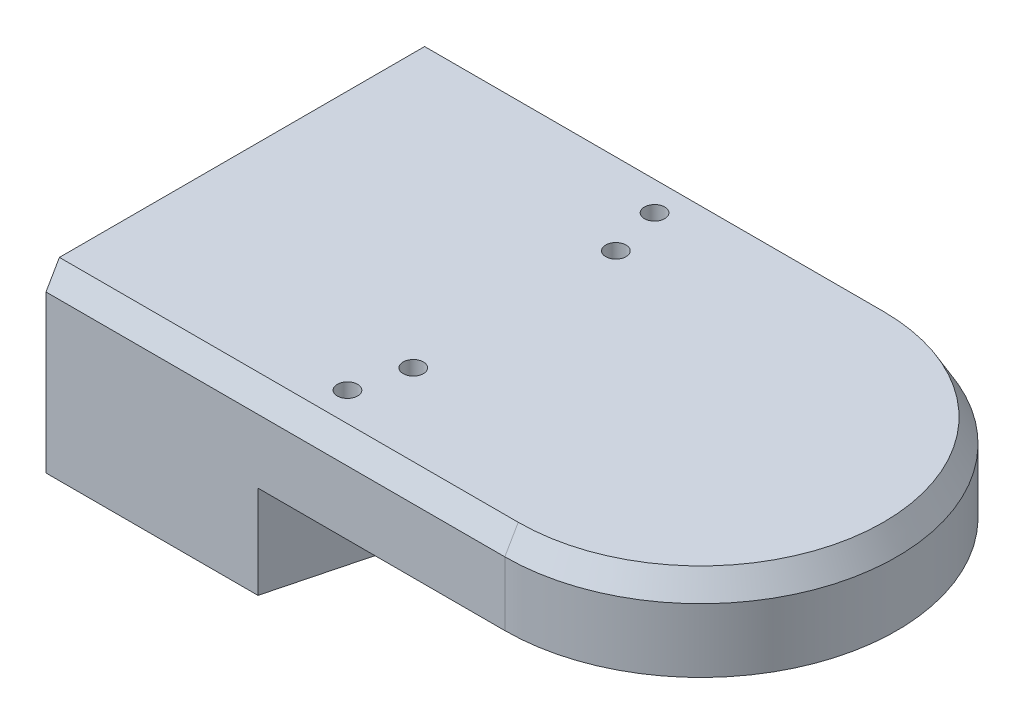
from build123d import *
from OCP.BRepFilletAPI import BRepFilletAPI_MakeChamfer

# Parameters (mm, degrees)
SALIENTE_EXTRUIR2_DEPTH = 23
CROQUIS7_R              = 20
CORTAR_EXTRUIR1_DEPTH   = 16
CROQUIS8_R              = 10.25
CORTAR_EXTRUIR2_DEPTH   = 65.838641661
SALIENTE_EXTRUIR3_START = 32
CROQUIS9_R              = 20
CROQUIS9_R_2            = 3.075
CROQUIS9_R_3            = 10.25
SALIENTE_EXTRUIR3_DEPTH = 32
CORTAR_EXTRUIR3_START   = -7
CROQUIS10_R             = 20
CORTAR_EXTRUIR3_DEPTH   = 112.607172695
SALIENTE_EXTRUIR4_START = 20
CROQUIS11_R             = 3.075
CROQUIS11_R_2           = 20
SALIENTE_EXTRUIR4_DEPTH = 20
CROQUIS12_R             = 63
CORTAR_EXTRUIR4_DEPTH   = 3
CROQUIS13_R             = 55
CORTAR_EXTRUIR5_DEPTH   = 10
SALIENTE_EXTRUIR5_START = 10
SALIENTE_EXTRUIR5_DEPTH = 10
CHAFL_N1_SIZE           = 8
CHAFL_N1_SIZE2          = 4.618802154
CROQUIS15_R             = 6
CORTAR_EXTRUIR6_DEPTH   = 14.8
CORTAR_EXTRUIR7_REACH   = 233.334
CROQUIS17_R             = 1.5
CORTAR_EXTRUIR9_REACH   = 225.907
CROQUIS19_R             = 1.5
CORTAR_EXTRUIR10_START  = -50
CORTAR_EXTRUIR10_DEPTH  = 50
CORTAR_EXTRUIR11_DEPTH  = 50
CROQUIS22_R             = 3
CORTAR_EXTRUIR12_DEPTH  = 3
CROQUIS23_R             = 3
CORTAR_EXTRUIR13_DEPTH  = 3
CROQUIS25_R             = 2.5
CORTAR_EXTRUIR15_DEPTH  = 30
CROQUIS24_R             = 2.5
CORTAR_EXTRUIR14_DEPTH  = 30
CROQUIS26_R             = 2
CORTAR_EXTRUIR16_DEPTH  = 223.070371729
CROQUIS27_R             = 3.5
CORTAR_EXTRUIR17_DEPTH  = 5
CORTAR_EXTRUIR18_DEPTH  = 3.25
CROQUIS29_R             = 1.5
CORTAR_EXTRUIR19_DEPTH  = 10


with BuildPart() as part:
    # Croquis2 → Saliente-Extruir2 (new body)
    with BuildSketch(Plane(origin=(0, 0, 0), x_dir=(1, 0, 0), z_dir=(0, 1, 0))):
        with BuildLine():
            Line((32.725022686, -35), (-35, -35))
            Line((-35, -35), (-35, 35))
            Line((-35, 35), (38, 35))
            Line((38, 35), (52.182846342, -19.705264464))
            ThreePointArc((52.182846342, -19.705264464), (38.869791903, -20.762030653), (32.5, -32.5))
            ThreePointArc((32.5, -32.5), (32.556369153, -33.755053307), (32.725022686, -35))
        make_face()
    extrude(amount=SALIENTE_EXTRUIR2_DEPTH)

    # Croquis7 → Cortar-Extruir1 (cut)
    with BuildSketch(Plane(origin=(0, 23, 0), x_dir=(1, 0, 0), z_dir=(0, 1, 0))):
        with Locations(Location((1.5, -1.5, 0), (0, 0, 270))):
            Circle(CROQUIS7_R)
    extrude(amount=-CORTAR_EXTRUIR1_DEPTH, mode=Mode.SUBTRACT)

    # Croquis8 → Cortar-Extruir2 (cut, through all)
    with BuildSketch(Plane(origin=(0, 7, 0), x_dir=(1, 0, 0), z_dir=(0, 1, 0))):
        with Locations(Location((1.5, -1.5, 0), (0, 0, 270))):
            Circle(CROQUIS8_R)
    extrude(amount=-CORTAR_EXTRUIR2_DEPTH, mode=Mode.SUBTRACT)

    # Croquis9 → Saliente-Extruir3 (add)
    with BuildSketch(Plane(origin=(0, 23, 0), x_dir=(1, 0, 0), z_dir=(0, 1, 0)).offset(SALIENTE_EXTRUIR3_START)):
        with BuildLine():
            Line((-35, 35), (-35, -100))
            Line((-35, -100), (38, -100))
            Line((38, -100), (54.849357366, -35.009621588))
            ThreePointArc((54.849357366, -35.009621588), (55.169388384, -32.5), (54.849357366, -29.990378412))
            Line((54.849357366, -29.990378412), (38, 35))
            Line((38, 35), (-35, 35))
        make_face()
        with Locations(Location((1.5, -1.5, 0), (0, 0, 270))):
            Circle(CROQUIS9_R, mode=Mode.SUBTRACT)
        with Locations(Location((46.5, -32.5, 0), (0, 0, 270))):
            Circle(CROQUIS9_R_2, mode=Mode.SUBTRACT)
        with Locations(Location((1.5, -63.5, 0), (0, 0, 90))):
            Circle(CROQUIS9_R_3, mode=Mode.SUBTRACT)
    extrude(amount=-SALIENTE_EXTRUIR3_DEPTH)

    # Croquis10 → Cortar-Extruir3 (cut, through all)
    with BuildSketch(Plane.XZ.offset(-23).offset(CORTAR_EXTRUIR3_START)):
        with Locations(Location((1.5, 63.5, 0), (0, 0, 90))):
            Circle(CROQUIS10_R)
    extrude(amount=-CORTAR_EXTRUIR3_DEPTH, mode=Mode.SUBTRACT)

    # Croquis11 → Saliente-Extruir4 (add)
    with BuildSketch(Plane(origin=(0, 55, 0), x_dir=(1, 0, 0), z_dir=(0, 1, 0)).offset(SALIENTE_EXTRUIR4_START)):
        with BuildLine():
            Line((123, 35), (-35, 35))
            Line((-35, 35), (-35, -100))
            Line((-35, -100), (123, -100))
            ThreePointArc((123, -100), (190.5, -32.5), (123, 35))
        make_face()
        with Locations(Location((46.5, -32.5, 0), (0, 0, 270))):
            Circle(CROQUIS11_R, mode=Mode.SUBTRACT)
        with Locations(Location((1.5, -63.5, 0), (0, 0, 270))):
            Circle(CROQUIS11_R_2, mode=Mode.SUBTRACT)
        with Locations(Location((1.5, -1.5, 0), (0, 0, 270))):
            Circle(CROQUIS11_R_2, mode=Mode.SUBTRACT)
    extrude(amount=-SALIENTE_EXTRUIR4_DEPTH)

    # Croquis12 → Cortar-Extruir4 (cut)
    with BuildSketch(Plane.XZ.offset(-55)):
        with Locations(Location((123, 32.5, 0), (0, 0, 270))):
            Circle(CROQUIS12_R)
    extrude(amount=-CORTAR_EXTRUIR4_DEPTH, mode=Mode.SUBTRACT)

    # Croquis13 → Cortar-Extruir5 (cut)
    with BuildSketch(Plane.XZ.offset(-58)):
        with Locations(Location((123, 32.5, 0), (0, 0, 270))):
            Circle(CROQUIS13_R)
    extrude(amount=-CORTAR_EXTRUIR5_DEPTH, mode=Mode.SUBTRACT)

    # Croquis14 → Saliente-Extruir5 (add)
    with BuildSketch(Plane(origin=(0, 75, 0), x_dir=(1, 0, 0), z_dir=(0, 1, 0)).offset(SALIENTE_EXTRUIR5_START)):
        with BuildLine():
            Line((-35, -100), (123, -100))
            ThreePointArc((123, -100), (190.5, -32.5), (123, 35))
            Line((123, 35), (-35, 35))
            Line((-35, 35), (-35, -100))
        make_face()
    extrude(amount=-SALIENTE_EXTRUIR5_DEPTH)

    # Chaflán1: one chamfer whose edges measure the first distance from different faces: ONE call of the kernel's chamfer builder (chamfer() names one face for all edges)
    chafl_n1_edges_1 = [part.edges().sort_by_distance(p)[0] for p in [
        (190.5, 85, 32.5),
    ]]
    chafl_n1_side_1 = [part.faces().sort_by_distance(p)[0] for p in [
        (190.5, 70, 32.5),
    ]]
    chafl_n1_edges_2 = [part.edges().sort_by_distance(p)[0] for p in [
        (44, 85, -35),
    ]]
    chafl_n1_side_2 = [part.faces().sort_by_distance(p)[0] for p in [
        (24.509708738, 50.509708738, -35),
    ]]
    chafl_n1_edges_3 = [part.edges().sort_by_distance(p)[0] for p in [
        (44, 85, 100),
    ]]
    chafl_n1_side_3 = [part.faces().sort_by_distance(p)[0] for p in [
        (29.969474279, 59.765969474, 100),
    ]]
    chafl_n1 = BRepFilletAPI_MakeChamfer(part.part.solid().wrapped)
    for e in chafl_n1_edges_1:
        chafl_n1.Add(CHAFL_N1_SIZE, CHAFL_N1_SIZE2, e.wrapped, chafl_n1_side_1[0].wrapped)  # the first distance lies on this face
    for e in chafl_n1_edges_2:
        chafl_n1.Add(CHAFL_N1_SIZE, CHAFL_N1_SIZE2, e.wrapped, chafl_n1_side_2[0].wrapped)  # the first distance lies on this face
    for e in chafl_n1_edges_3:
        chafl_n1.Add(CHAFL_N1_SIZE, CHAFL_N1_SIZE2, e.wrapped, chafl_n1_side_3[0].wrapped)  # the first distance lies on this face
    add(Compound.cast(chafl_n1.Shape()), mode=Mode.REPLACE)

    # Croquis15 → Cortar-Extruir6 (cut)
    with BuildSketch(Plane.XZ.offset(-68)):
        with Locations(Location((123, 32.5, 0), (0, 0, 270))):
            Circle(CROQUIS15_R)
    extrude(amount=-CORTAR_EXTRUIR6_DEPTH, mode=Mode.SUBTRACT)

    # Croquis17 → Cortar-Extruir7 (cut, up to next)
    with BuildSketch(Plane.XZ, mode=Mode.PRIVATE) as cortar_extruir7_sk1:
        with Locations(Location((16.5, 1.5, 0), (0, 0, 270))):
            Circle(CROQUIS17_R)
    cortar_extruir7_tool1 = extrude(cortar_extruir7_sk1.sketch, amount=-CORTAR_EXTRUIR7_REACH, mode=Mode.PRIVATE) & part.part
    # Croquis17 → Cortar-Extruir7 (cut, up to next)
    with BuildSketch(Plane.XZ, mode=Mode.PRIVATE) as cortar_extruir7_sk2:
        with Locations(Location((-6, -11.490381057, 0), (0, 0, 270))):
            Circle(CROQUIS17_R)
    cortar_extruir7_tool2 = extrude(cortar_extruir7_sk2.sketch, amount=-CORTAR_EXTRUIR7_REACH, mode=Mode.PRIVATE) & part.part
    # Croquis17 → Cortar-Extruir7 (cut, up to next)
    with BuildSketch(Plane.XZ, mode=Mode.PRIVATE) as cortar_extruir7_sk3:
        with Locations(Location((-6, 14.490381057, 0), (0, 0, 270))):
            Circle(CROQUIS17_R)
    cortar_extruir7_tool3 = extrude(cortar_extruir7_sk3.sketch, amount=-CORTAR_EXTRUIR7_REACH, mode=Mode.PRIVATE) & part.part
    # Croquis17 → Cortar-Extruir7 (cut, up to next)
    with BuildSketch(Plane.XZ, mode=Mode.PRIVATE) as cortar_extruir7_sk4:
        with Locations(Location((13.624355653, 8.5, 0), (0, 0, 270))):
            Circle(CROQUIS17_R)
    cortar_extruir7_tool4 = extrude(cortar_extruir7_sk4.sketch, amount=-CORTAR_EXTRUIR7_REACH, mode=Mode.PRIVATE) & part.part
    # Croquis17 → Cortar-Extruir7 (cut, up to next)
    with BuildSketch(Plane.XZ, mode=Mode.PRIVATE) as cortar_extruir7_sk5:
        with Locations(Location((1.5, -12.5, 0), (0, 0, 270))):
            Circle(CROQUIS17_R)
    cortar_extruir7_tool5 = extrude(cortar_extruir7_sk5.sketch, amount=-CORTAR_EXTRUIR7_REACH, mode=Mode.PRIVATE) & part.part
    # Croquis17 → Cortar-Extruir7 (cut, up to next)
    with BuildSketch(Plane.XZ, mode=Mode.PRIVATE) as cortar_extruir7_sk6:
        with Locations(Location((-10.624355653, 8.5, 0), (0, 0, 270))):
            Circle(CROQUIS17_R)
    cortar_extruir7_tool6 = extrude(cortar_extruir7_sk6.sketch, amount=-CORTAR_EXTRUIR7_REACH, mode=Mode.PRIVATE) & part.part
    add(cortar_extruir7_tool1.solids().sort_by_distance((16.5, 0, 1.5))[0], mode=Mode.SUBTRACT)
    add(cortar_extruir7_tool2.solids().sort_by_distance((-6, 0, -11.490381))[0], mode=Mode.SUBTRACT)
    add(cortar_extruir7_tool3.solids().sort_by_distance((-6, 0, 14.490381))[0], mode=Mode.SUBTRACT)
    add(cortar_extruir7_tool4.solids().sort_by_distance((13.624356, 0, 8.5))[0], mode=Mode.SUBTRACT)
    add(cortar_extruir7_tool5.solids().sort_by_distance((1.5, 0, -12.5))[0], mode=Mode.SUBTRACT)
    add(cortar_extruir7_tool6.solids().sort_by_distance((-10.624356, 0, 8.5))[0], mode=Mode.SUBTRACT)

    # Croquis19 → Cortar-Extruir9 (cut, up to next)
    with BuildSketch(Plane.XZ.offset(-23), mode=Mode.PRIVATE) as cortar_extruir9_sk1:
        with Locations(Location((16.5, 63.5, 0), (0, 0, 270))):
            Circle(CROQUIS19_R)
    cortar_extruir9_tool1 = extrude(cortar_extruir9_sk1.sketch, amount=-CORTAR_EXTRUIR9_REACH, mode=Mode.PRIVATE) & part.part
    # Croquis19 → Cortar-Extruir9 (cut, up to next)
    with BuildSketch(Plane.XZ.offset(-23), mode=Mode.PRIVATE) as cortar_extruir9_sk2:
        with Locations(Location((-6, 50.509618943, 0), (0, 0, 270))):
            Circle(CROQUIS19_R)
    cortar_extruir9_tool2 = extrude(cortar_extruir9_sk2.sketch, amount=-CORTAR_EXTRUIR9_REACH, mode=Mode.PRIVATE) & part.part
    # Croquis19 → Cortar-Extruir9 (cut, up to next)
    with BuildSketch(Plane.XZ.offset(-23), mode=Mode.PRIVATE) as cortar_extruir9_sk3:
        with Locations(Location((-6, 76.490381057, 0), (0, 0, 270))):
            Circle(CROQUIS19_R)
    cortar_extruir9_tool3 = extrude(cortar_extruir9_sk3.sketch, amount=-CORTAR_EXTRUIR9_REACH, mode=Mode.PRIVATE) & part.part
    # Croquis19 → Cortar-Extruir9 (cut, up to next)
    with BuildSketch(Plane.XZ.offset(-23), mode=Mode.PRIVATE) as cortar_extruir9_sk4:
        with Locations(Location((13.624355653, 70.5, 0), (0, 0, 270))):
            Circle(CROQUIS19_R)
    cortar_extruir9_tool4 = extrude(cortar_extruir9_sk4.sketch, amount=-CORTAR_EXTRUIR9_REACH, mode=Mode.PRIVATE) & part.part
    # Croquis19 → Cortar-Extruir9 (cut, up to next)
    with BuildSketch(Plane.XZ.offset(-23), mode=Mode.PRIVATE) as cortar_extruir9_sk5:
        with Locations(Location((1.5, 49.5, 0), (0, 0, 270))):
            Circle(CROQUIS19_R)
    cortar_extruir9_tool5 = extrude(cortar_extruir9_sk5.sketch, amount=-CORTAR_EXTRUIR9_REACH, mode=Mode.PRIVATE) & part.part
    # Croquis19 → Cortar-Extruir9 (cut, up to next)
    with BuildSketch(Plane.XZ.offset(-23), mode=Mode.PRIVATE) as cortar_extruir9_sk6:
        with Locations(Location((-10.624355653, 70.5, 0), (0, 0, 270))):
            Circle(CROQUIS19_R)
    cortar_extruir9_tool6 = extrude(cortar_extruir9_sk6.sketch, amount=-CORTAR_EXTRUIR9_REACH, mode=Mode.PRIVATE) & part.part
    add(cortar_extruir9_tool1.solids().sort_by_distance((16.5, 23, 63.5))[0], mode=Mode.SUBTRACT)
    add(cortar_extruir9_tool2.solids().sort_by_distance((-6, 23, 50.509619))[0], mode=Mode.SUBTRACT)
    add(cortar_extruir9_tool3.solids().sort_by_distance((-6, 23, 76.490381))[0], mode=Mode.SUBTRACT)
    add(cortar_extruir9_tool4.solids().sort_by_distance((13.624356, 23, 70.5))[0], mode=Mode.SUBTRACT)
    add(cortar_extruir9_tool5.solids().sort_by_distance((1.5, 23, 49.5))[0], mode=Mode.SUBTRACT)
    add(cortar_extruir9_tool6.solids().sort_by_distance((-10.624356, 23, 70.5))[0], mode=Mode.SUBTRACT)

    # Croquis20 → Cortar-Extruir10 (cut)
    with BuildSketch(Plane.XZ.offset(CORTAR_EXTRUIR10_START)):
        with BuildLine():
            Line((42.3656995, 5.747113524), (39.773106907, -4.252886476))
            ThreePointArc((39.773106907, -4.252886476), (38.705054743, -5.872620854), (36.869116213, -6.5))
            Line((36.869116213, -6.5), (19.83030278, -6.5))
            ThreePointArc((19.83030278, -6.5), (21.5, 1.5), (19.83030278, 9.5))
            Line((19.83030278, 9.5), (39.461708805, 9.5))
            ThreePointArc((39.461708805, 9.5), (41.834329659, 8.33593853), (42.3656995, 5.747113524))
        make_face()
    extrude(amount=CORTAR_EXTRUIR10_DEPTH, mode=Mode.SUBTRACT)

    # Croquis21 → Cortar-Extruir11 (cut)
    with BuildSketch(Plane.XZ.offset(-23)):
        with BuildLine():
            Line((39.461708805, 55.5), (19.83030278, 55.5))
            ThreePointArc((19.83030278, 55.5), (21.5, 63.5), (19.83030278, 71.5))
            Line((19.83030278, 71.5), (36.869116213, 71.5))
            ThreePointArc((36.869116213, 71.5), (38.705054743, 70.872620854), (39.773106907, 69.252886476))
            Line((39.773106907, 69.252886476), (42.3656995, 59.252886476))
            ThreePointArc((42.3656995, 59.252886476), (41.834329659, 56.66406147), (39.461708805, 55.5))
        make_face()
    extrude(amount=-CORTAR_EXTRUIR11_DEPTH, mode=Mode.SUBTRACT)

    # Croquis22 → Cortar-Extruir12 (cut)
    with BuildSketch(Plane.XZ):
        with Locations(Location((-6, 14.490381057, 0), (0, 0, 270))):
            Circle(CROQUIS22_R)
        with Locations(Location((-10.624355653, 8.5, 0), (0, 0, 270))):
            Circle(CROQUIS22_R)
        with Locations(Location((-6, -11.490381057, 0), (0, 0, 270))):
            Circle(CROQUIS22_R)
        with Locations(Location((1.5, -12.5, 0), (0, 0, 270))):
            Circle(CROQUIS22_R)
        with Locations(Location((16.5, 1.5, 0), (0, 0, 270))):
            Circle(CROQUIS22_R)
        with Locations(Location((13.624355653, 8.5, 0), (0, 0, 270))):
            Circle(CROQUIS22_R)
    extrude(amount=-CORTAR_EXTRUIR12_DEPTH, mode=Mode.SUBTRACT)

    # Croquis23 → Cortar-Extruir13 (cut)
    with BuildSketch(Plane.XZ.offset(-23)):
        with Locations(Location((-6, 76.490381057, 0), (0, 0, 270))):
            Circle(CROQUIS23_R)
        with Locations(Location((-10.624355653, 70.5, 0), (0, 0, 270))):
            Circle(CROQUIS23_R)
        with Locations(Location((-6, 50.509618943, 0), (0, 0, 270))):
            Circle(CROQUIS23_R)
        with Locations(Location((1.5, 49.5, 0), (0, 0, 270))):
            Circle(CROQUIS23_R)
        with Locations(Location((16.5, 63.5, 0), (0, 0, 270))):
            Circle(CROQUIS23_R)
        with Locations(Location((13.624355653, 70.5, 0), (0, 0, 270))):
            Circle(CROQUIS23_R)
    extrude(amount=-CORTAR_EXTRUIR13_DEPTH, mode=Mode.SUBTRACT)

    # Croquis25 → Cortar-Extruir15 (cut)
    with BuildSketch(Plane.XZ.offset(-23)):
        with Locations(Location((-28.75, 63.5, 0), (0, 0, 270))):
            Circle(CROQUIS25_R)
        with Locations(Location((29, 47, 0), (0, 0, 270))):
            Circle(CROQUIS25_R)
    extrude(amount=-CORTAR_EXTRUIR15_DEPTH, mode=Mode.SUBTRACT)

    # Croquis24 → Cortar-Extruir14 (cut)
    with BuildSketch(Plane.XZ):
        with Locations(Location((-28.75, 1.5, 0), (0, 0, 270))):
            Circle(CROQUIS24_R)
        with Locations(Location((25, 25, 0), (0, 0, 270))):
            Circle(CROQUIS24_R)
    extrude(amount=-CORTAR_EXTRUIR14_DEPTH, mode=Mode.SUBTRACT)

    # Croquis26 → Cortar-Extruir16 (cut, through all)
    with BuildSketch(Plane.XZ.offset(-55)):
        with Locations(Location((54.186793756, 85.381197846, 0), (0, 0, 270))):
            Circle(CROQUIS26_R)
        with Locations(Location((58.853460423, 67.381197846, 0), (0, 0, 270))):
            Circle(CROQUIS26_R)
        with Locations(Location((58.853460423, -2.381197846, 0), (0, 0, 90))):
            Circle(CROQUIS26_R)
        with Locations(Location((54.186793756, -20.381197846, 0), (0, 0, 90))):
            Circle(CROQUIS26_R)
    extrude(amount=-CORTAR_EXTRUIR16_DEPTH, mode=Mode.SUBTRACT)

    # Croquis27 → Cortar-Extruir17 (cut)
    with BuildSketch(Plane(origin=(0, 85, 0), x_dir=(1, 0, 0), z_dir=(0, 1, 0))):
        with Locations(Location((54.186793756, 20.381197846, 0), (0, 0, 270))):
            Circle(CROQUIS27_R)
        with Locations(Location((58.853460423, 2.381197846, 0), (0, 0, 270))):
            Circle(CROQUIS27_R)
        with Locations(Location((58.853460423, -67.381197846, 0), (0, 0, 270))):
            Circle(CROQUIS27_R)
        with Locations(Location((54.186793756, -85.381197846, 0), (0, 0, 270))):
            Circle(CROQUIS27_R)
    extrude(amount=-CORTAR_EXTRUIR17_DEPTH, mode=Mode.SUBTRACT)

    # Croquis28 → Cortar-Extruir18 (cut)
    with BuildSketch(Plane.XZ.offset(-55)):
        Polygon((55.222779206, 81.385253968), (58.165375392, 84.280415625), (57.129389942, 88.276359503), (53.150808306, 89.377141725), (50.20821212, 86.481980068), (51.24419757, 82.48603619), align=None)
        Polygon((59.889445873, 63.385253968), (62.832042059, 66.280415625), (61.796056609, 70.276359503), (57.817474973, 71.377141725), (54.874878787, 68.481980068), (55.910864237, 64.48603619), align=None)
        Polygon((59.889445873, 1.614746032), (55.910864237, 0.51396381), (54.874878787, -3.481980068), (57.817474973, -6.377141725), (61.796056609, -5.276359503), (62.832042059, -1.280415625), align=None)
        Polygon((55.222779206, -16.385253968), (51.24419757, -17.48603619), (50.20821212, -21.481980068), (53.150808306, -24.377141725), (57.129389942, -23.276359503), (58.165375392, -19.280415625), align=None)
    extrude(amount=-CORTAR_EXTRUIR18_DEPTH, mode=Mode.SUBTRACT)

    # Croquis29 → Cortar-Extruir19 (cut)
    with BuildSketch(Plane.XZ.offset(-68)):
        with Locations(Location((160.5, 32.5, 0), (0, 0, 270))):
            Circle(CROQUIS29_R)
        with Locations(Location((141.75, 0.024047358, 0), (0, 0, 270))):
            Circle(CROQUIS29_R)
        with Locations(Location((104.25, 0.024047358, 0), (0, 0, 270))):
            Circle(CROQUIS29_R)
        with Locations(Location((85.5, 32.5, 0), (0, 0, 270))):
            Circle(CROQUIS29_R)
        with Locations(Location((104.25, 64.975952642, 0), (0, 0, 270))):
            Circle(CROQUIS29_R)
        with Locations(Location((141.75, 64.975952642, 0), (0, 0, 270))):
            Circle(CROQUIS29_R)
    extrude(amount=-CORTAR_EXTRUIR19_DEPTH, mode=Mode.SUBTRACT)


solid = part.part
